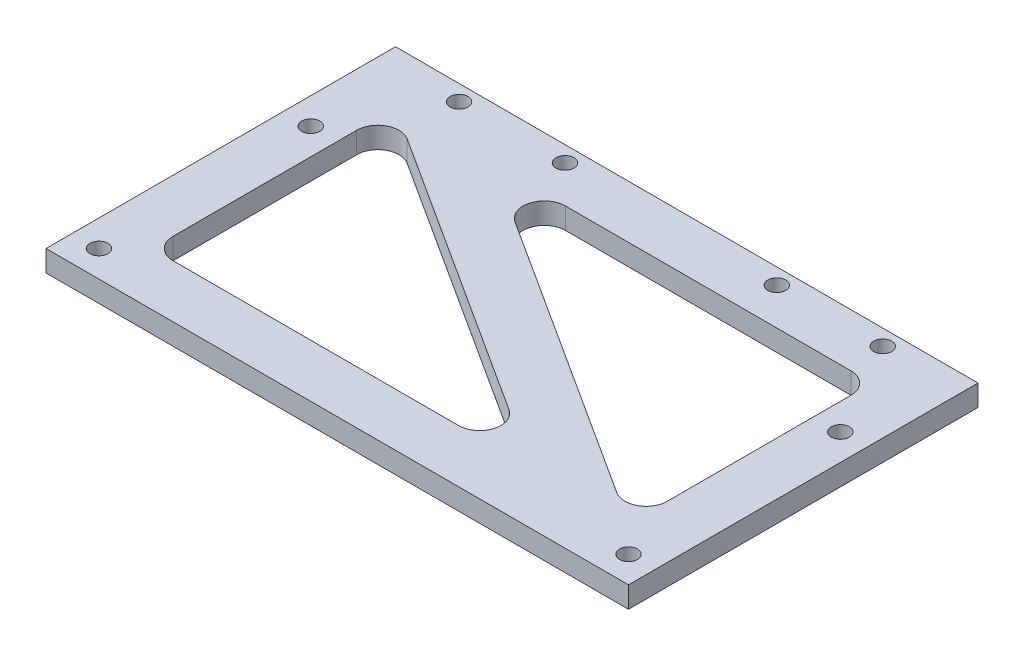
from build123d import *

# Parameters (mm, degrees)
SKETCH_1_W          = 110
SKETCH_1_H          = 66
SKETCH_1_R          = 1.7
EXTRUDE_1_DEPTH     = 4
CUT_EXTRUDE_1_DEPTH = 10
FILLET_1_R          = 4


with BuildPart() as part:
    # 草图1 → 凸台-拉伸1 (new body)
    with BuildSketch(Plane(origin=(0, 0, 0), x_dir=(1, 0, 0), z_dir=(0, 1, 0))):
        with Locations((55, 33)):
            Rectangle(SKETCH_1_W, SKETCH_1_H)
        with Locations(Location((5, 45, 0), (0, 0, 270))):
            Circle(SKETCH_1_R, mode=Mode.SUBTRACT)
        with Locations(Location((5, 5, 0), (0, 0, 270))):
            Circle(SKETCH_1_R, mode=Mode.SUBTRACT)
        with Locations(Location((105, 5, 0), (0, 0, 90))):
            Circle(SKETCH_1_R, mode=Mode.SUBTRACT)
        with Locations(Location((105, 45, 0), (0, 0, 90))):
            Circle(SKETCH_1_R, mode=Mode.SUBTRACT)
        with Locations(Location((15, 63, 0), (0, 0, 270))):
            Circle(SKETCH_1_R, mode=Mode.SUBTRACT)
        with Locations(Location((35, 63, 0), (0, 0, 270))):
            Circle(SKETCH_1_R, mode=Mode.SUBTRACT)
        with Locations(Location((75, 63, 0), (0, 0, 90))):
            Circle(SKETCH_1_R, mode=Mode.SUBTRACT)
        with Locations(Location((95, 63, 0), (0, 0, 90))):
            Circle(SKETCH_1_R, mode=Mode.SUBTRACT)
    extrude(amount=EXTRUDE_1_DEPTH)

    # 草图2 → 切除-拉伸1 (cut)
    with BuildSketch(Plane.XZ):
        Polygon((100, -56), (100, -10), (28.485134293, -56), align=None)
        Polygon((10, -56), (81.514865707, -10), (10, -10), align=None)
    extrude(amount=-CUT_EXTRUDE_1_DEPTH, mode=Mode.SUBTRACT)

    # 圆角1
    fillet_1_edges = [part.edges().sort_by_distance(p)[0] for p in [
        (10, 2, -56),
        (10, 2, -10),
        (81.514865707, 2, -10),
        (100, 2, -56),
        (28.485134293, 2, -56),
        (100, 2, -10),
    ]]
    fillet(fillet_1_edges, radius=FILLET_1_R)


solid = part.part
